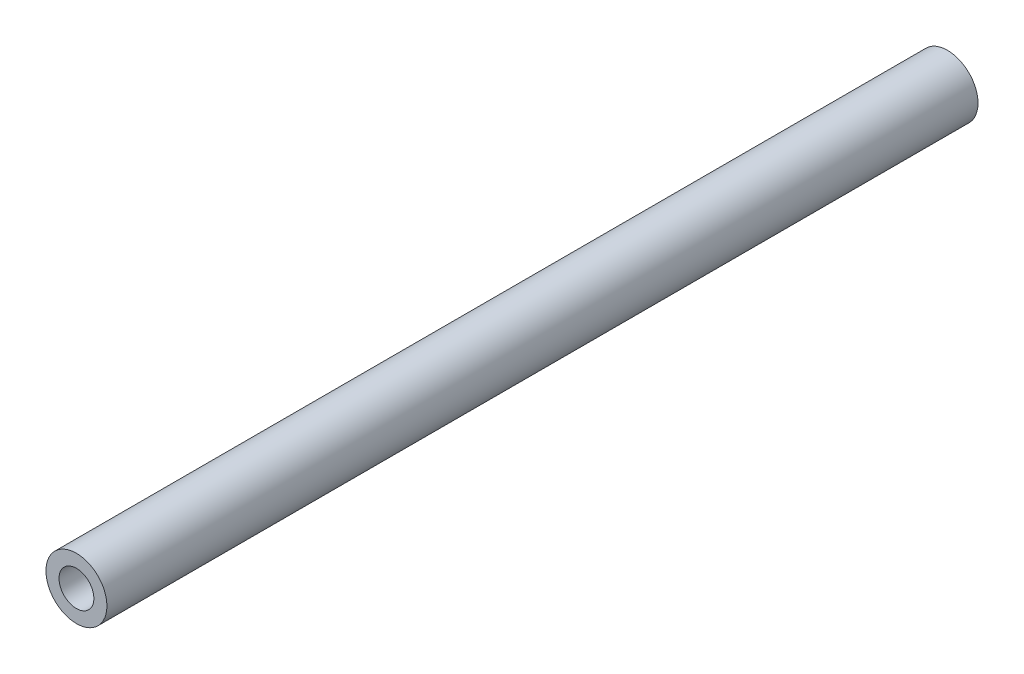
from build123d import *

# Parameters (mm, degrees)
SKETCH_1_R      = 1.75
SKETCH_1_R_2    = 1
EXTRUDE_1_DEPTH = 50


with BuildPart() as part:
    # 草图1 → 凸台-拉伸1 (new body)
    with BuildSketch(Plane.XY):
        Circle(SKETCH_1_R)
        Circle(SKETCH_1_R_2, mode=Mode.SUBTRACT)
    extrude(amount=EXTRUDE_1_DEPTH)


solid = part.part
